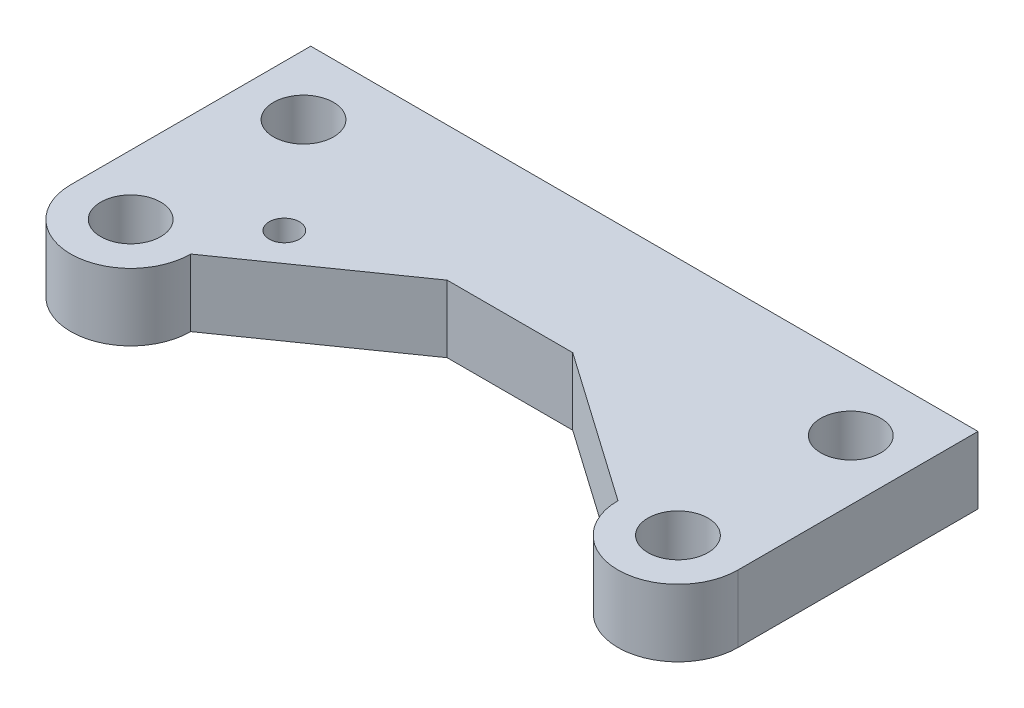
from build123d import *

# Parameters (mm, degrees)
SKETCH1_R           = 3.96875
SKETCH1_R_2         = 2
BOSS_EXTRUDE1_DEPTH = 8.89


with BuildPart() as part:
    # Sketch1 → Boss-Extrude1 (new body)
    with BuildSketch(Plane(origin=(0, 0, 0), x_dir=(1, 0, 0), z_dir=(0, 1, 0))):
        with BuildLine():
            Line((80.3275, 31.75), (-7.9375, 31.75))
            Line((-7.9375, 31.75), (-7.9375, 13.97))
            Line((-7.9375, 13.97), (-7.9375, 0))
            ThreePointArc((-7.9375, 0), (0, -7.9375), (7.9375, 0))
            Line((7.9375, 0), (27.888727654, 13.97))
            Line((27.888727654, 13.97), (44.501272346, 13.97))
            Line((44.501272346, 13.97), (64.4525, 0))
            ThreePointArc((64.4525, 0), (72.39, -7.9375), (80.3275, 0))
            Line((80.3275, 0), (80.3275, 13.97))
            Line((80.3275, 13.97), (80.3275, 31.75))
        make_face()
        with Locations(Location((0, 0, 0), (0, 0, 270))):
            Circle(SKETCH1_R, mode=Mode.SUBTRACT)
        with Locations(Location((72.39, 0, 0), (0, 0, 270))):
            Circle(SKETCH1_R, mode=Mode.SUBTRACT)
        with Locations(Location((72.39, 22.86, 0), (0, 0, 270))):
            Circle(SKETCH1_R, mode=Mode.SUBTRACT)
        with Locations(Location((0, 22.86, 0), (0, 0, 270))):
            Circle(SKETCH1_R, mode=Mode.SUBTRACT)
        with Locations(Location((11.43, 8.89, 0), (0, 0, 270))):
            Circle(SKETCH1_R_2, mode=Mode.SUBTRACT)
    extrude(amount=-BOSS_EXTRUDE1_DEPTH)


solid = part.part
